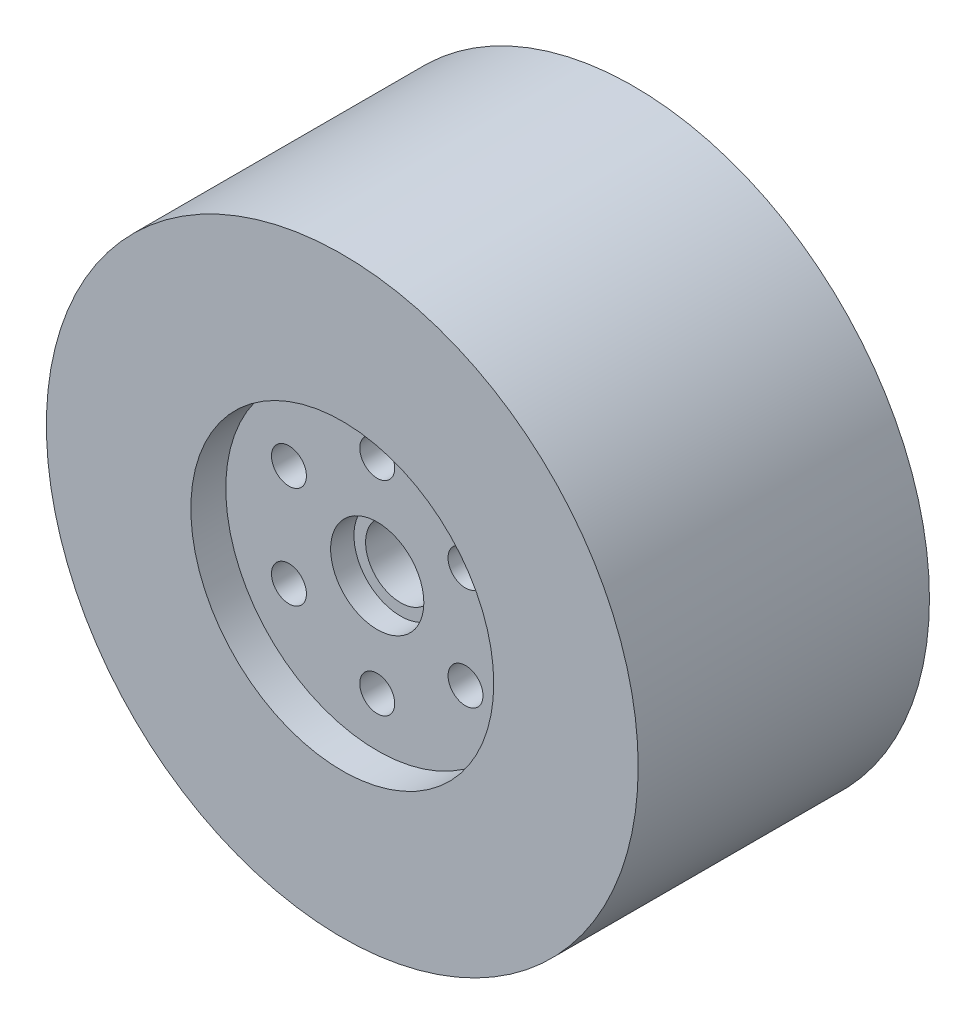
from build123d import *

# Parameters (mm, degrees)
SKETCH1_R           = 25.4
BOSS_EXTRUDE1_DEPTH = 25
SKETCH2_R           = 3
CUT_EXTRUDE1_DEPTH  = 44.764369069
SKETCH4_R           = 4
CUT_EXTRUDE4_DEPTH  = 2
SKETCH6_R           = 13
CUT_EXTRUDE6_DEPTH  = 3
SKETCH9_R           = 1.5
CUT_EXTRUDE7_DEPTH  = 5
CUT_EXTRUDE8_START  = -5
SKETCH3_R           = 4
CUT_EXTRUDE8_DEPTH  = 5
CIRPATTERN1_COUNT   = 6


with BuildPart() as part:
    # Sketch1 → Boss-Extrude1 (new body)
    with BuildSketch(Plane.XY):
        Circle(SKETCH1_R)
    extrude(amount=BOSS_EXTRUDE1_DEPTH)

    # Sketch2 → Cut-Extrude1 (cut, through all)
    with BuildSketch(Plane.XY.offset(25)):
        Circle(SKETCH2_R)
    extrude(amount=-CUT_EXTRUDE1_DEPTH, mode=Mode.SUBTRACT)

    # Sketch4 → Cut-Extrude4 (cut)
    with BuildSketch(Plane(origin=(0, 0, 0), x_dir=(-1, 0, 0), z_dir=(0, 0, -1))):
        Circle(SKETCH4_R)
    extrude(amount=-CUT_EXTRUDE4_DEPTH, mode=Mode.SUBTRACT)

    # Sketch6 → Cut-Extrude6 (cut)
    with BuildSketch(Plane.XY.offset(25)):
        Circle(SKETCH6_R)
    extrude(amount=-CUT_EXTRUDE6_DEPTH, mode=Mode.SUBTRACT)

    # Sketch9 → Cut-Extrude7 (cut)
    with BuildSketch(Plane.XY.offset(22)):
        with Locations((0, 8.75)):
            Circle(SKETCH9_R)
    cut_extrude7 = extrude(amount=-CUT_EXTRUDE7_DEPTH, mode=Mode.SUBTRACT)

    # Sketch3 → Cut-Extrude8 (cut)
    with BuildSketch(Plane.XY.offset(25).offset(CUT_EXTRUDE8_START)):
        with Locations(Location((0, 0, 0), (0, 0, 180))):
            Circle(SKETCH3_R)
    extrude(amount=CUT_EXTRUDE8_DEPTH, mode=Mode.SUBTRACT)

    # CirPattern1: Cut-Extrude7 ×6 about axis
    cirpattern1_axis = Axis((0, 0, 0), (0, 0, 1))
    for i in range(1, CIRPATTERN1_COUNT):
        add(cut_extrude7.rotate(cirpattern1_axis, i * 360 / CIRPATTERN1_COUNT), mode=Mode.SUBTRACT)


solid = part.part
